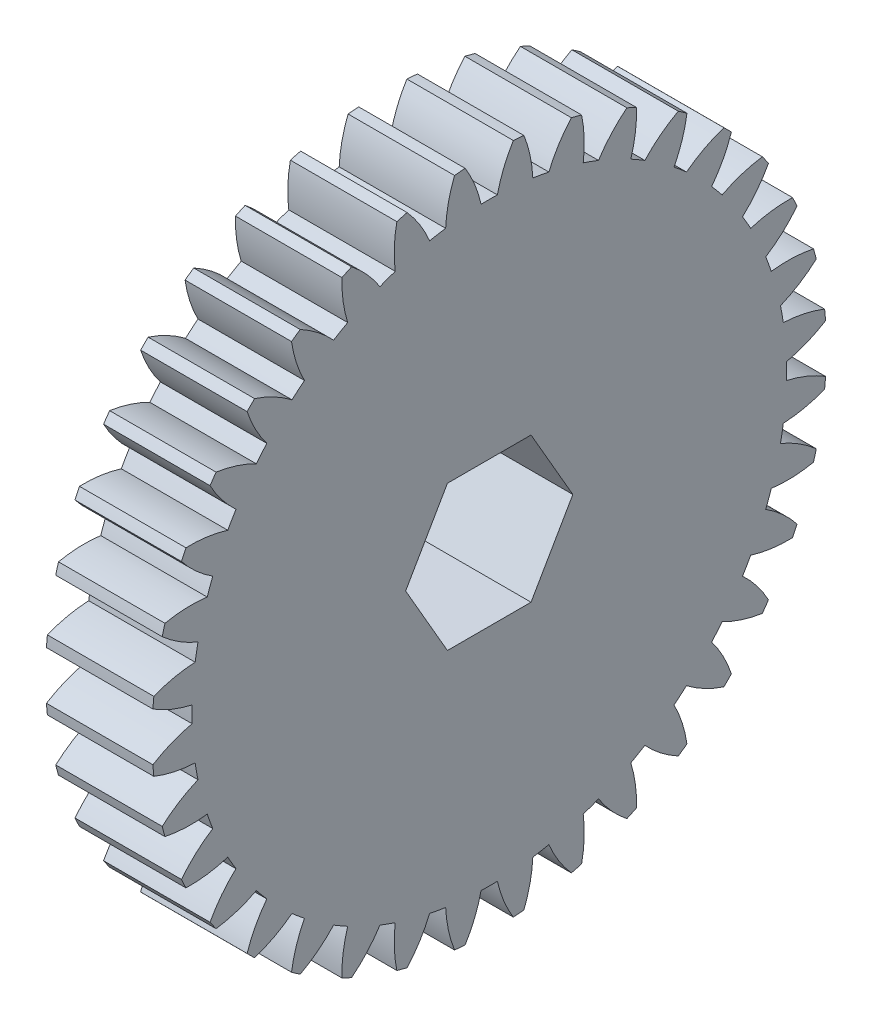
from build123d import *

# Parameters (mm, degrees)
BASPROSKE_W        = 6.35
BASPROSKE_H        = 20.108333333
TOOTHCUT_DEPTH     = 30.137821451
TEETHCUTS_COUNT    = 36
TEETHCUTS_ANGLE    = 350
BORSKE_R           = 0.396875
BORE_DEPTH         = 50.8000508
CUT_EXTRUDE1_DEPTH = 30.066836964


with BuildPart() as part:
    # BasProSke → Base-Revolve (revolve)
    with BuildSketch(Plane(origin=(0, 0, 0), x_dir=(1, 0, 0), z_dir=(0, 1, 0)), mode=Mode.PRIVATE) as base_revolve_sk:
        with Locations((3.175, 10.054166667)):
            Rectangle(BASPROSKE_W, BASPROSKE_H)
    revolve(base_revolve_sk.sketch.rotate(Axis((-10, 0, 0), (1, 0, 0)), 180), axis=Axis((-10, 0, 0), (1, 0, 0)))

    # TooCutSke → ToothCut (cut, through all)
    with BuildSketch(Plane(origin=(0, 0, 0), x_dir=(0, 0, -1), z_dir=(1, 0, 0))):
        with BuildLine():
            ThreePointArc((0.485894828, 17.722540418), (0, 17.7292), (-0.485894828, 17.722540418))
            ThreePointArc((-0.485894828, 17.722540418), (-0.869820886, 18.942611253), (-1.452410194, 20.081277912))
            ThreePointArc((-1.452410194, 20.081277912), (0, 20.133733333), (1.452410194, 20.081277912))
            ThreePointArc((1.452410194, 20.081277912), (0.869820886, 18.942611253), (0.485894828, 17.722540418))
        make_face()
    toothcut = extrude(amount=TOOTHCUT_DEPTH, mode=Mode.SUBTRACT)

    # TeethCuts: ToothCut ×36 about axis
    teethcuts_axis = Axis((-10, 0, 0), (1, 0, 0))
    for i in range(1, TEETHCUTS_COUNT):
        add(toothcut.rotate(teethcuts_axis, i * TEETHCUTS_ANGLE / (TEETHCUTS_COUNT - 1)), mode=Mode.SUBTRACT)

    # BorSke → Bore (cut, symmetric)
    with BuildSketch(Plane(origin=(0, 0, 0), x_dir=(0, 0, -1), z_dir=(1, 0, 0))):
        with Locations(Location((0, 0, 0), (0, 0, 180))):
            Circle(BORSKE_R)
    extrude(amount=BORE_DEPTH, both=True, mode=Mode.SUBTRACT)

    # Sketch1 → Cut-Extrude1 (cut, through all)
    with BuildSketch(Plane(origin=(6.35, 0, 0), x_dir=(0, 0, -1), z_dir=(1, 0, 0))):
        Polygon((-2.492998462, 4.318), (2.492998462, 4.318), (4.985996925, 0), (2.492998462, -4.318), (-2.492998462, -4.318), (-4.985996925, 0), align=None)
    extrude(amount=-CUT_EXTRUDE1_DEPTH, mode=Mode.SUBTRACT)


solid = part.part
